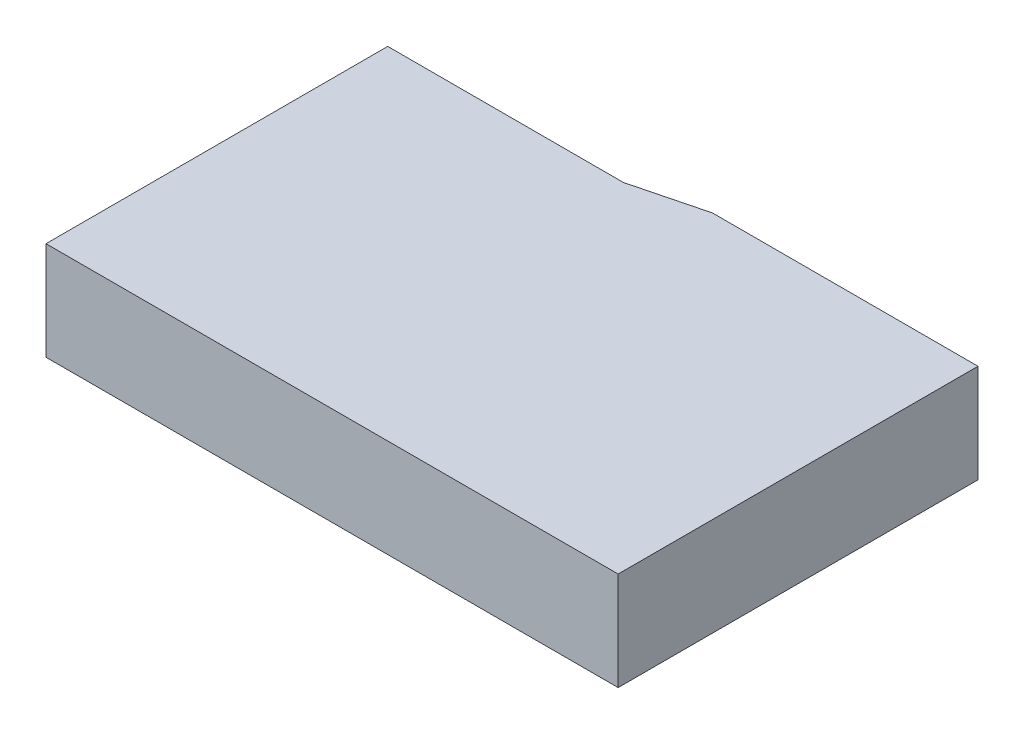
from build123d import *

# Parameters (mm, degrees)
SKETCH_1_W      = 110.5
SKETCH_1_H      = 66
EXTRUDE_1_DEPTH = 19
EXTRUDE_2_DEPTH = 19


with BuildPart() as part:
    # 草图1 → 凸台-拉伸1 (new body)
    with BuildSketch(Plane(origin=(0, 0, 0), x_dir=(1, 0, 0), z_dir=(0, 1, 0))):
        with Locations((55.25, -33)):
            Rectangle(SKETCH_1_W, SKETCH_1_H)
    extrude(amount=EXTRUDE_1_DEPTH)

    # 草图2 → 凸台-拉伸2 (add)
    with BuildSketch(Plane(origin=(0, 19, 0), x_dir=(1, 0, 0), z_dir=(0, 1, 0))):
        Polygon((110.5, 0), (45.531109974, 0), (59.21801075, 3.5), (110.5, 3.5), align=None)
    extrude(amount=-EXTRUDE_2_DEPTH)


solid = part.part
